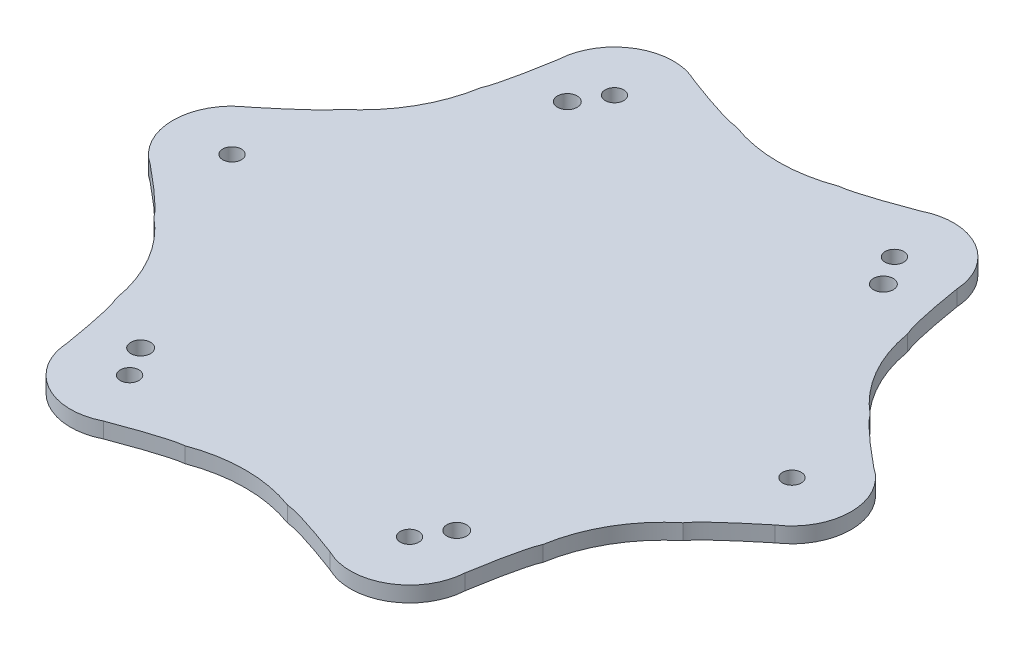
from build123d import *

# Parameters (mm, degrees)
SKETCH1_R           = 45
BOSS_EXTRUDE2_DEPTH = 2.5
BOSS_EXTRUDE4_START = -2.5
BOSS_EXTRUDE4_DEPTH = 2.5
CIRPATTERN1_COUNT   = 6
CUT_EXTRUDE2_DEPTH  = 2.5
SKETCH6_R           = 1.5
CUT_EXTRUDE3_DEPTH  = 5
SKETCH7_R           = 1.5875
CUT_EXTRUDE4_DEPTH  = 2.5


with BuildPart() as part:
    # Sketch1 → Boss-Extrude2 (new body)
    with BuildSketch(Plane(origin=(0, 0, 0), x_dir=(1, 0, 0), z_dir=(0, 1, 0))):
        with Locations(Location((0, 0, 0), (0, 0, 270))):
            Circle(SKETCH1_R)
    extrude(amount=BOSS_EXTRUDE2_DEPTH)

    # Sketch2 → Boss-Extrude4 (add)
    with BuildSketch(Plane(origin=(0, 2.5, 0), x_dir=(1, 0, 0), z_dir=(0, 1, 0)).offset(BOSS_EXTRUDE4_START)):
        with BuildLine():
            ThreePointArc((-42.23454554, 15.532004475), (-45, 0), (-42.23454554, -15.532004475))
            add(Edge.make_bspline(
                [(-50.212380227, -7.942360629), (-45.3159648, -11.95963121), (-42.656686571, -14.489512492), (-42.23454554, -15.532004475)],
                knots=[0.089311832, 0.089311832, 0.089311832, 0.089311832, 1, 1, 1, 1], degree=3))
            ThreePointArc((-50.212380227, -7.942360629), (-54.5, 0), (-50.212380227, 7.942360629))
            add(Edge.make_bspline(
                [(-50.212380227, 7.942360629), (-45.3159648, 11.95963121), (-42.656686571, 14.489512492), (-42.23454554, 15.532004475)],
                knots=[0.089311832, 0.089311832, 0.089311832, 0.089311832, 1, 1, 1, 1], degree=3))
        make_face()
    boss_extrude4 = extrude(amount=BOSS_EXTRUDE4_DEPTH)

    # CirPattern1: Boss-Extrude4 ×6 about axis
    cirpattern1_axis = Axis((0, 2.5, 0), (0, 1, 0))
    for i in range(1, CIRPATTERN1_COUNT):
        add(boss_extrude4.rotate(cirpattern1_axis, i * 360 / CIRPATTERN1_COUNT))

    # Sketch5 → Cut-Extrude2 (cut)
    with BuildSketch(Plane(origin=(0, 2.5, 0), x_dir=(1, 0, 0), z_dir=(0, 1, 0))):
        with BuildLine():
            Line((-8.22468756, 44.342191593), (0, 46.65782144))
            Line((0, 46.65782144), (8.22468756, 44.342191593))
            ThreePointArc((8.22468756, 44.342191593), (0, 42.851652617), (-8.22468756, 44.342191593))
        make_face()
        with BuildLine():
            Line((40.406858652, 23.32891072), (42.513808159, 15.048307431))
            ThreePointArc((42.513808159, 15.048307431), (37.11061976, 21.425826308), (34.289120599, 29.293884161))
            Line((34.289120599, 29.293884161), (40.406858652, 23.32891072))
        make_face()
        with BuildLine():
            Line((40.406858652, -23.32891072), (34.289120599, -29.293884161))
            ThreePointArc((34.289120599, -29.293884161), (37.11061976, -21.425826308), (42.513808159, -15.048307431))
            Line((42.513808159, -15.048307431), (40.406858652, -23.32891072))
        make_face()
        with BuildLine():
            Line((0, -46.65782144), (-8.22468756, -44.342191593))
            ThreePointArc((-8.22468756, -44.342191593), (0, -42.851652617), (8.22468756, -44.342191593))
            Line((8.22468756, -44.342191593), (0, -46.65782144))
        make_face()
        with BuildLine():
            Line((-40.406858652, -23.32891072), (-42.513808159, -15.048307431))
            ThreePointArc((-42.513808159, -15.048307431), (-37.11061976, -21.425826308), (-34.289120599, -29.293884161))
            Line((-34.289120599, -29.293884161), (-40.406858652, -23.32891072))
        make_face()
        with BuildLine():
            Line((-40.406858652, 23.32891072), (-34.289120599, 29.293884161))
            ThreePointArc((-34.289120599, 29.293884161), (-37.11061976, 21.425826308), (-42.513808159, 15.048307431))
            Line((-42.513808159, 15.048307431), (-40.406858652, 23.32891072))
        make_face()
    extrude(amount=-CUT_EXTRUDE2_DEPTH, mode=Mode.SUBTRACT)

    # Sketch6 → Cut-Extrude3 (cut, symmetric)
    with BuildSketch(Plane(origin=(0, 2.5, 0), x_dir=(1, 0, 0), z_dir=(0, 1, 0))):
        with Locations(Location((-45, 0, 0), (0, 0, 270))):
            Circle(SKETCH6_R)
        with Locations(Location((-22.5, 38.97114317, 0), (0, 0, 270))):
            Circle(SKETCH6_R)
        with Locations(Location((22.5, 38.97114317, 0), (0, 0, 270))):
            Circle(SKETCH6_R)
        with Locations(Location((45, 0, 0), (0, 0, 270))):
            Circle(SKETCH6_R)
        with Locations(Location((22.5, -38.97114317, 0), (0, 0, 270))):
            Circle(SKETCH6_R)
        with Locations(Location((-22.5, -38.97114317, 0), (0, 0, 270))):
            Circle(SKETCH6_R)
    extrude(amount=CUT_EXTRUDE3_DEPTH, both=True, mode=Mode.SUBTRACT)

    # Sketch7 → Cut-Extrude4 (cut)
    with BuildSketch(Plane(origin=(0, 2.5, 0), x_dir=(1, 0, 0), z_dir=(0, 1, 0))):
        with Locations(Location((-25.4, 34.29, 0), (0, 0, 270))):
            Circle(SKETCH7_R)
        with Locations(Location((-25.4, -34.29, 0), (0, 0, 270))):
            Circle(SKETCH7_R)
        with Locations(Location((25.4, -34.29, 0), (0, 0, 270))):
            Circle(SKETCH7_R)
        with Locations(Location((25.4, 34.29, 0), (0, 0, 270))):
            Circle(SKETCH7_R)
    extrude(amount=-CUT_EXTRUDE4_DEPTH, mode=Mode.SUBTRACT)


solid = part.part
